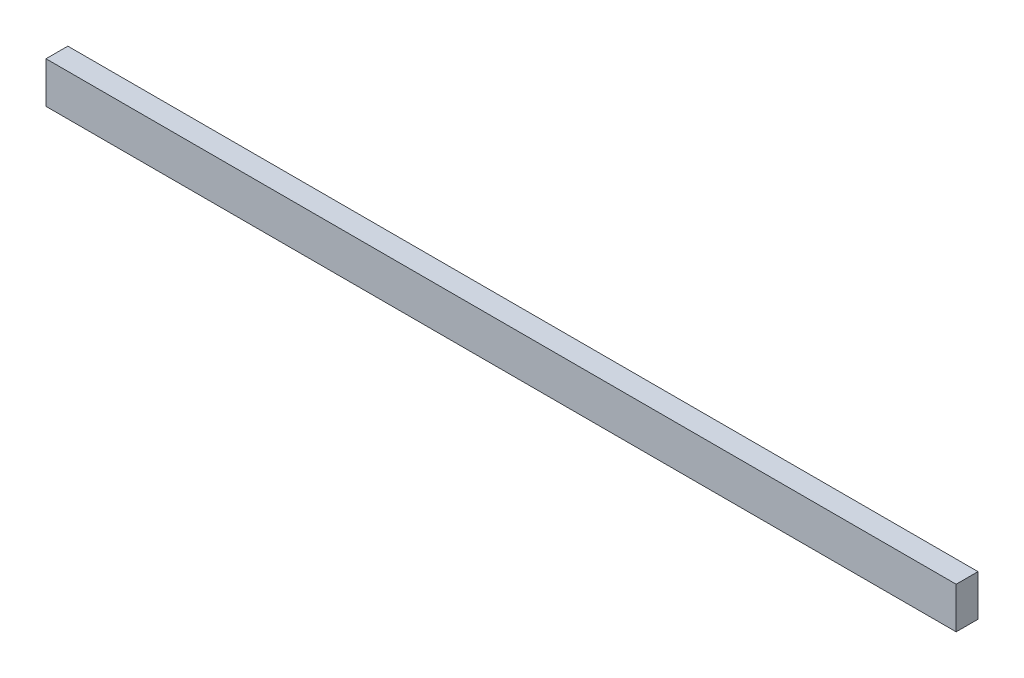
from build123d import *

# Parameters (mm, degrees)
SKETCH1_W           = 750
SKETCH1_H           = 34
BOSS_EXTRUDE1_DEPTH = 18


with BuildPart() as part:
    # Sketch1 → Boss-Extrude1 (new body)
    with BuildSketch(Plane.XY):
        Rectangle(SKETCH1_W, SKETCH1_H)
    extrude(amount=BOSS_EXTRUDE1_DEPTH)


solid = part.part
